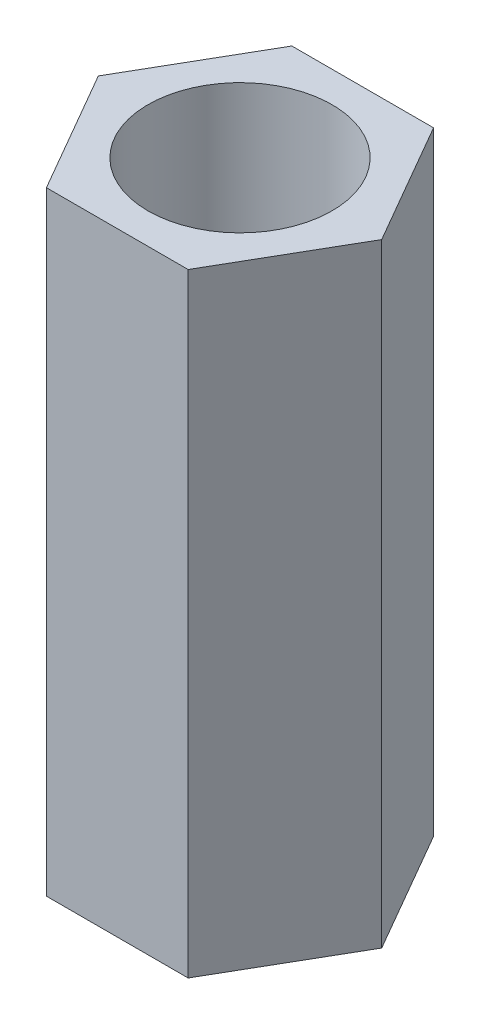
from build123d import *

# Parameters (mm, degrees)
EXTRUDE_1_DEPTH     = 10
SKETCH_2_R          = 1.5
CUT_EXTRUDE_1_DEPTH = 11.456258094


with BuildPart() as part:
    # 草图1 → 凸台-拉伸1 (new body)
    with BuildSketch(Plane(origin=(0, 0, 0), x_dir=(1, 0, 0), z_dir=(0, 1, 0))):
        Polygon((2.309401077, 0), (1.154700538, 2), (-1.154700538, 2), (-2.309401077, 0), (-1.154700538, -2), (1.154700538, -2), align=None)
    extrude(amount=EXTRUDE_1_DEPTH)

    # 草图2 → 切除-拉伸1 (cut, through all)
    with BuildSketch(Plane(origin=(0, 10, 0), x_dir=(1, 0, 0), z_dir=(0, 1, 0))):
        with Locations(Location((0, 0, 0), (0, 0, 270))):
            Circle(SKETCH_2_R)
    extrude(amount=-CUT_EXTRUDE_1_DEPTH, mode=Mode.SUBTRACT)


solid = part.part
